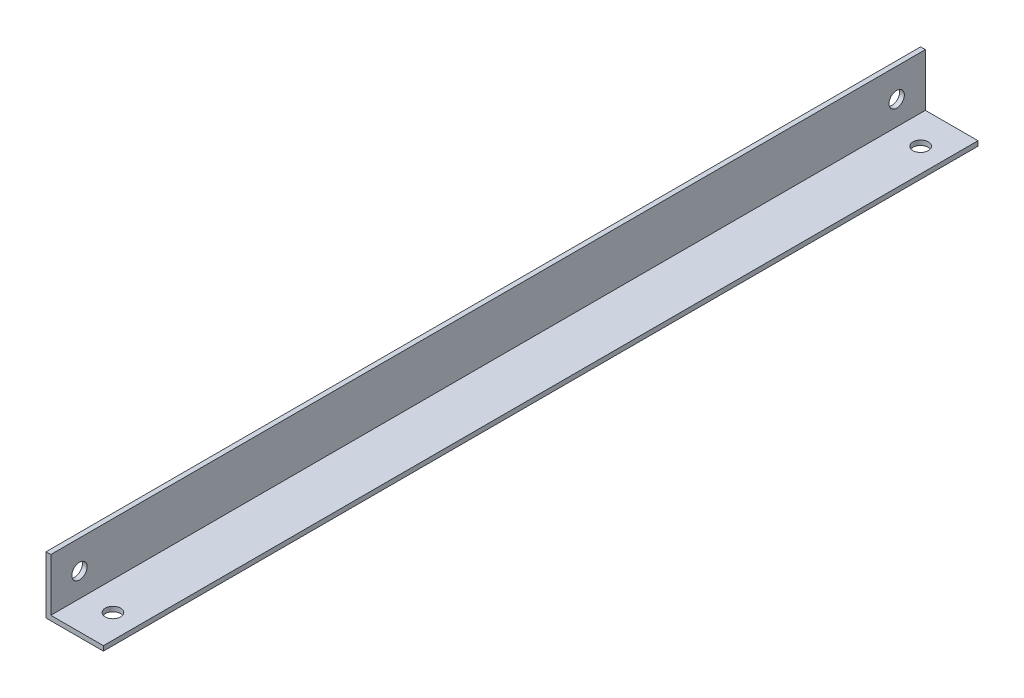
from build123d import *

# Parameters (mm, degrees)
BOSS_EXTRUDE1_DEPTH = 457.2
SKETCH2_R           = 4
CUT_EXTRUDE1_DEPTH  = 460.007723247
SKETCH3_R           = 4
CUT_EXTRUDE2_DEPTH  = 460.007723247


with BuildPart() as part:
    # Sketch1 → Boss-Extrude1 (new body)
    with BuildSketch(Plane.XY):
        Polygon((0, 0), (0, 30), (2.5, 30), (2.5, 2.5), (30, 2.5), (30, 0), align=None)
    extrude(amount=BOSS_EXTRUDE1_DEPTH)

    # Sketch2 → Cut-Extrude1 (cut, through all)
    with BuildSketch(Plane(origin=(0, 2.5, 0), x_dir=(1, 0, 0), z_dir=(0, 1, 0))):
        with Locations(Location((17.5, -17.5, 0), (0, 0, 180))):
            Circle(SKETCH2_R)
        with Locations(Location((17.5, -439.7, 0), (0, 0, 180))):
            Circle(SKETCH2_R)
    extrude(amount=-CUT_EXTRUDE1_DEPTH, mode=Mode.SUBTRACT)

    # Sketch3 → Cut-Extrude2 (cut, through all)
    with BuildSketch(Plane(origin=(2.5, 0, 0), x_dir=(0, 0, -1), z_dir=(1, 0, 0))):
        with Locations(Location((-15, 15, 0), (0, 0, 90))):
            Circle(SKETCH3_R)
        with Locations(Location((-442.2, 15, 0), (0, 0, 270))):
            Circle(SKETCH3_R)
    extrude(amount=-CUT_EXTRUDE2_DEPTH, mode=Mode.SUBTRACT)


solid = part.part
